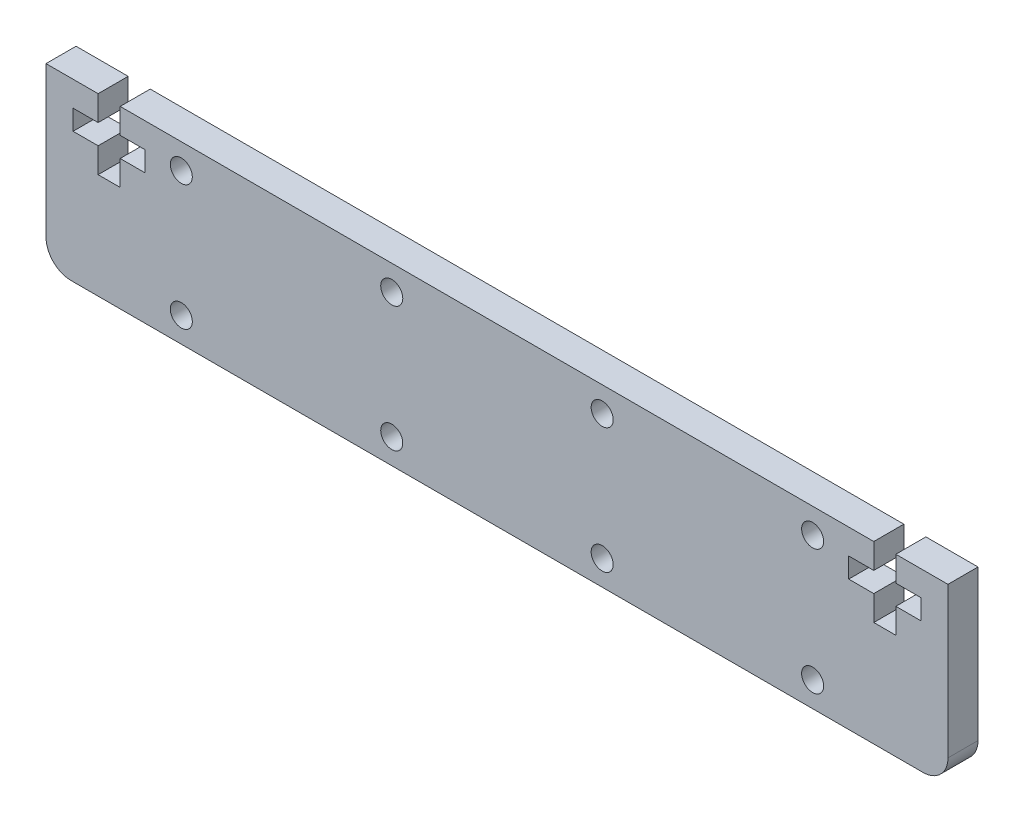
from build123d import *

# Parameters (mm, degrees)
SKETCH1_R           = 1.1
BOSS_EXTRUDE1_DEPTH = 3
FILLET1_R           = 2.5


with BuildPart() as part:
    # Sketch1 → Boss-Extrude1 (new body)
    with BuildSketch(Plane.XY):
        Polygon((-45, -8.75), (45, -8.75), (45, 8.75), (39.8, 8.75), (39.8, 6.25), (42.3, 6.25), (42.3, 4.25), (39.8, 4.25), (39.8, 1.75), (37.6, 1.75), (37.6, 4.25), (35.1, 4.25), (35.1, 6.25), (37.6, 6.25), (37.6, 8.75), (-37.6, 8.75), (-37.6, 6.25), (-35.1, 6.25), (-35.1, 4.25), (-37.6, 4.25), (-37.6, 1.75), (-39.8, 1.75), (-39.8, 4.25), (-42.3, 4.25), (-42.3, 6.25), (-39.8, 6.25), (-39.8, 8.75), (-45, 8.75), align=None)
        with Locations((-10.5, 6.25)):
            Circle(SKETCH1_R, mode=Mode.SUBTRACT)
        with Locations(Location((-10.5, -6.25, 0), (0, 0, 180))):
            Circle(SKETCH1_R, mode=Mode.SUBTRACT)
        with Locations((10.5, -6.25)):
            Circle(SKETCH1_R, mode=Mode.SUBTRACT)
        with Locations(Location((10.5, 6.25, 0), (0, 0, 180))):
            Circle(SKETCH1_R, mode=Mode.SUBTRACT)
        with Locations((-31.5, 6.25)):
            Circle(SKETCH1_R, mode=Mode.SUBTRACT)
        with Locations(Location((-31.5, -6.25, 0), (0, 0, 180))):
            Circle(SKETCH1_R, mode=Mode.SUBTRACT)
        with Locations((31.5, -6.25)):
            Circle(SKETCH1_R, mode=Mode.SUBTRACT)
        with Locations(Location((31.5, 6.25, 0), (0, 0, 180))):
            Circle(SKETCH1_R, mode=Mode.SUBTRACT)
    extrude(amount=BOSS_EXTRUDE1_DEPTH)

    # Fillet1
    fillet1_edges = [part.edges().sort_by_distance(p)[0] for p in [
        (45, -8.75, 1.5),
        (-45, -8.75, 1.5),
    ]]
    fillet(fillet1_edges, radius=FILLET1_R)


solid = part.part
